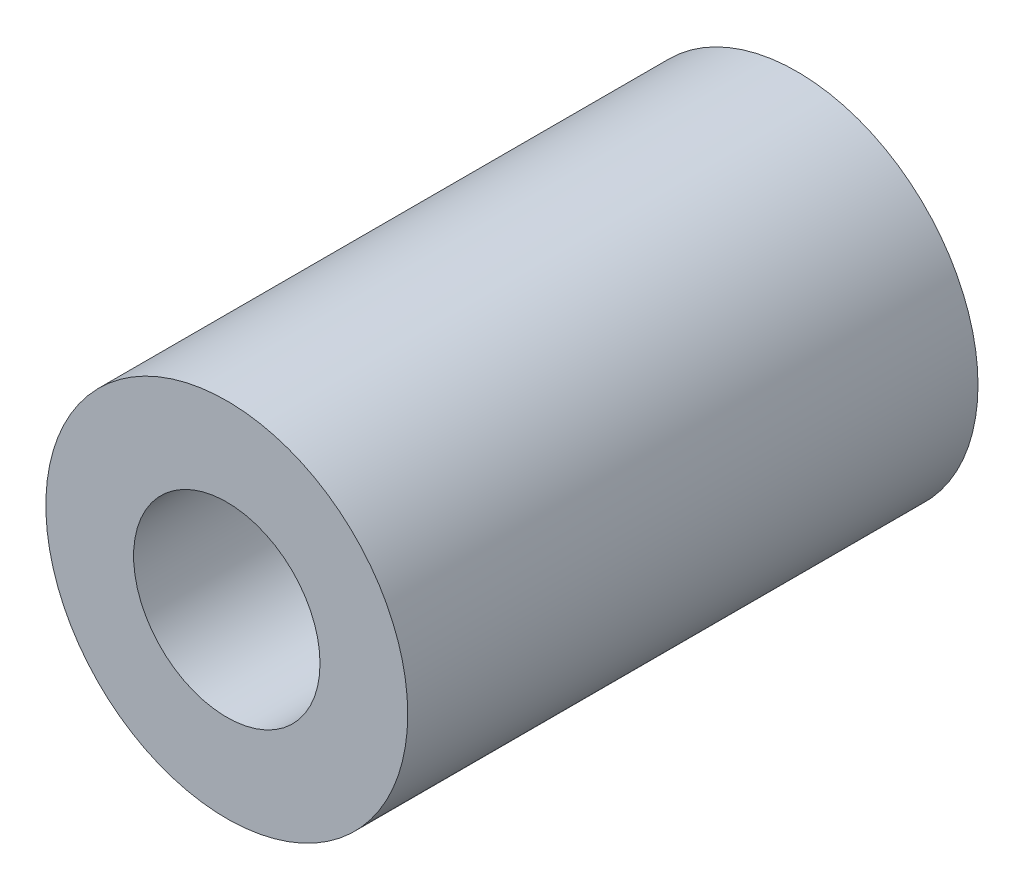
from build123d import *

# Parameters (mm, degrees)
SKETCH1_R           = 3.3
SKETCH1_R_2         = 1.7
BOSS_EXTRUDE1_DEPTH = 10.4


with BuildPart() as part:
    # Sketch1 → Boss-Extrude1 (new body)
    with BuildSketch(Plane.XY):
        Circle(SKETCH1_R)
        Circle(SKETCH1_R_2, mode=Mode.SUBTRACT)
    extrude(amount=BOSS_EXTRUDE1_DEPTH)


solid = part.part
